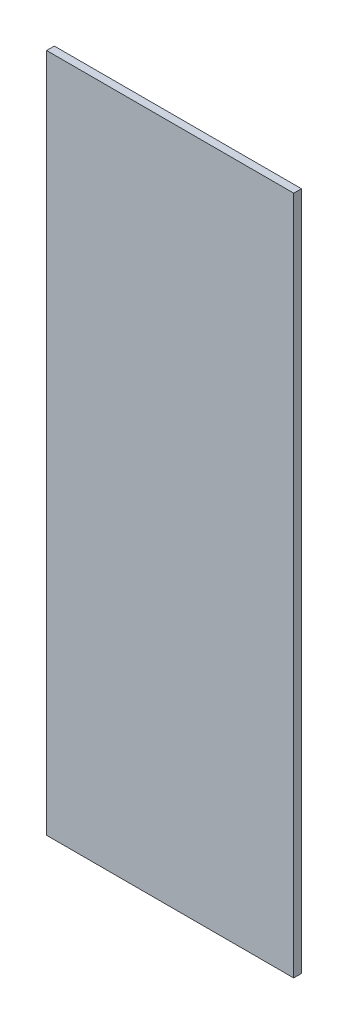
from build123d import *

# Parameters (mm, degrees)
SKETCH_1_W      = 80
SKETCH_1_H      = 220
EXTRUDE_1_DEPTH = 2.5


with BuildPart() as part:
    # 草图1 → 凸台-拉伸1 (new body)
    with BuildSketch(Plane.XY):
        Rectangle(SKETCH_1_W, SKETCH_1_H)
    extrude(amount=EXTRUDE_1_DEPTH)


solid = part.part
